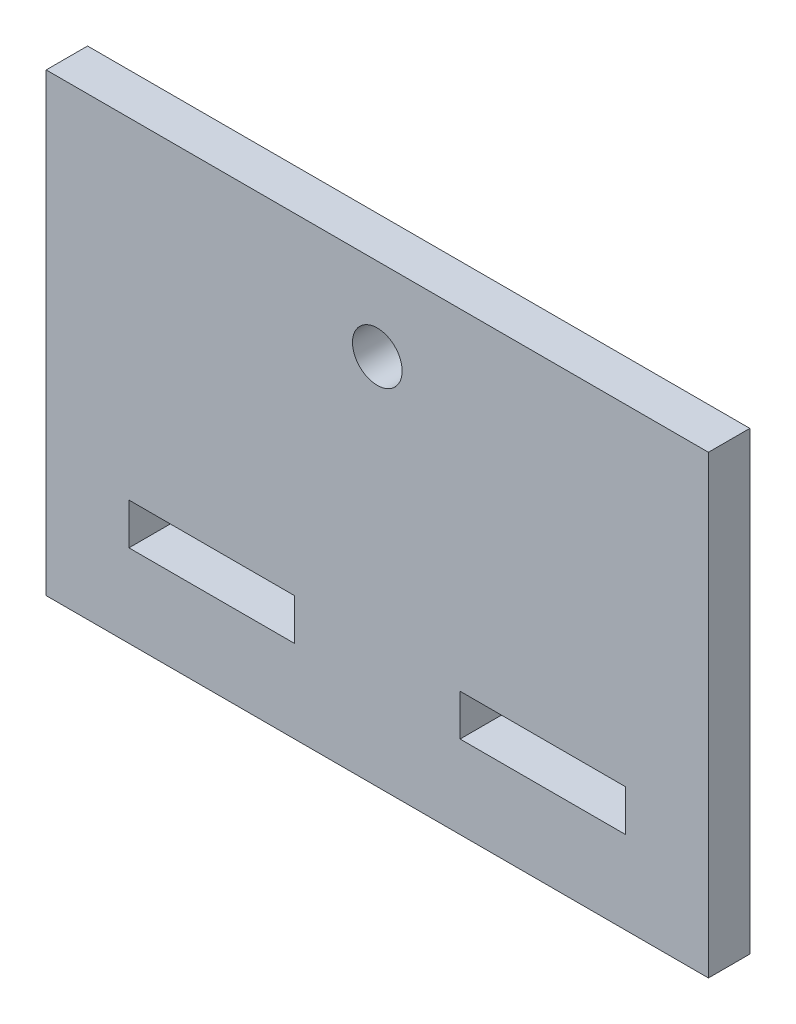
from build123d import *

# Parameters (mm, degrees)
SKETCH1_W           = 50.8
SKETCH1_H           = 34.925
SKETCH1_R           = 1.905
SKETCH1_W_2         = 12.7
SKETCH1_H_2         = 3.175
BOSS_EXTRUDE1_DEPTH = 3.175


with BuildPart() as part:
    # Sketch1 → Boss-Extrude1 (new body)
    with BuildSketch(Plane.XY):
        with Locations((25.4, 17.4625)):
            Rectangle(SKETCH1_W, SKETCH1_H)
        with Locations((25.4, 28.575)):
            Circle(SKETCH1_R, mode=Mode.SUBTRACT)
        with Locations((12.7, 7.9375)):
            Rectangle(SKETCH1_W_2, SKETCH1_H_2, mode=Mode.SUBTRACT)
        with Locations((38.1, 7.9375)):
            Rectangle(SKETCH1_W_2, SKETCH1_H_2, mode=Mode.SUBTRACT)
    extrude(amount=BOSS_EXTRUDE1_DEPTH)


solid = part.part
